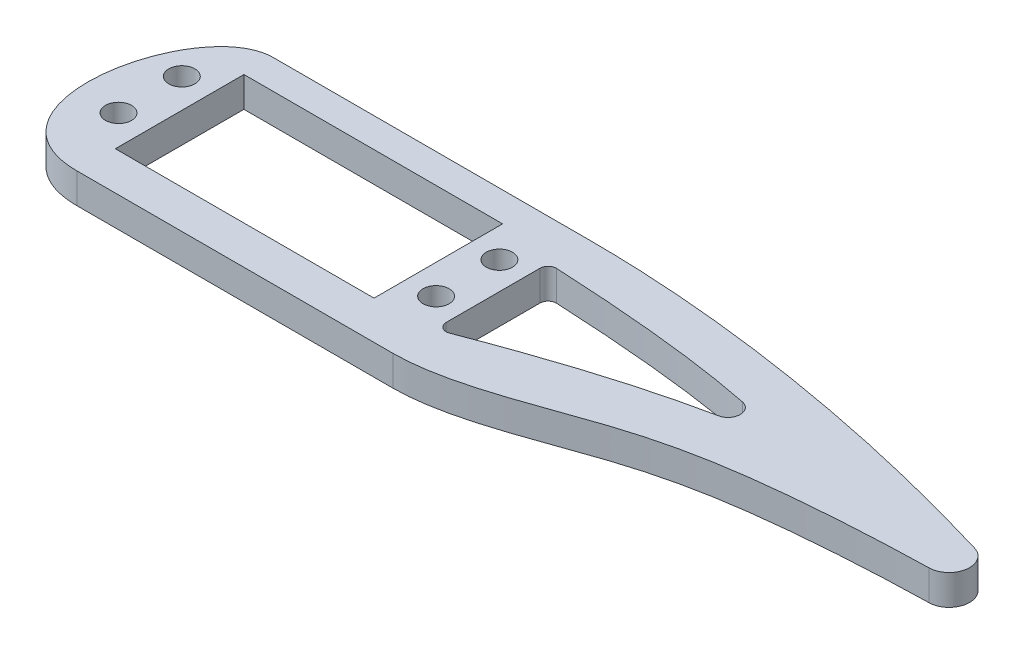
from build123d import *

# Parameters (mm, degrees)
BOSS_EXTRUDE1_DEPTH = 4.699
SKETCH2_R           = 1.905
SKETCH2_R_2         = 2.032
SKETCH2_W           = 40.259
SKETCH2_H           = 20.0152
CUT_EXTRUDE1_DEPTH  = 105.14657371
FILLET1_R           = 1.27


with BuildPart() as part:
    # Sketch1 → Boss-Extrude1 (new body)
    with BuildSketch(Plane(origin=(0, 0, 0), x_dir=(1, 0, 0), z_dir=(0, 1, 0))):
        with BuildLine():
            Line((-20.1295, 14.5796), (29.0195, 14.5796))
            add(Edge.make_bspline(
                [(29.0195, 14.5796), (61.676259281, 14.5796), (92.626496887, 5.406179728), (100.540261174, 3.042166683)],
                knots=[0, 0, 0, 0, 1, 1, 1, 1], degree=3))
            ThreePointArc((100.540261174, 3.042166683), (102.777881706, -0.425331821), (99.699916451, -3.174262779))
            add(Edge.make_bspline(
                [(29.0195, -15.9766), (36.752411566, -15.9766), (47.448783559, -11.662139755), (61.563248496, -6.964298313), (74.754433056, -4.344440996), (91.245915547, -3.356476028), (99.699916451, -3.174262779)],
                knots=[0, 0, 0, 0, 0.316402814, 0.381996868, 0.65594054, 1, 1, 1, 1], degree=3))
            Line((29.0195, -15.9766), (-20.1295, -15.9766))
            add(Edge.make_bspline(
                [(-20.1295, 14.5796), (-25.650459674, 14.5796), (-34.705495366, -0.225155417), (-29.383489197, -15.9766), (-20.1295, -15.9766)],
                knots=[0, 0, 0, 0, 0.484878873, 1, 1, 1, 1], degree=3))
        make_face()
    extrude(amount=BOSS_EXTRUDE1_DEPTH)

    # Sketch2 → Cut-Extrude1 (cut, through all)
    with BuildSketch(Plane(origin=(0, 4.699, 0), x_dir=(1, 0, 0), z_dir=(0, 1, 0))):
        with Locations((62.4205, 2.803132377)):
            Circle(SKETCH2_R)
        with Locations(Location((-24.71166, 4.92506, 0), (0, 0, 270))):
            Circle(SKETCH2_R_2)
        with Locations(Location((-24.71166, -4.92506, 0), (0, 0, 270))):
            Circle(SKETCH2_R_2)
        with Locations(Location((24.71166, -4.92506, 0), (0, 0, 270))):
            Circle(SKETCH2_R_2)
        with Locations(Location((24.71166, 4.92506, 0), (0, 0, 270))):
            Circle(SKETCH2_R_2)
        with BuildLine():
            Line((29.0195, 0), (29.0195, 8.262060115))
            add(Edge.make_bspline(
                [(29.0195, 8.262060115), (49.82184103, 7.331297412), (62.803182548, 4.669299323)],
                knots=[0, 0, 0, 1, 1, 1], degree=2))
            ThreePointArc((62.803182548, 4.669299323), (64.32549921, 2.801397362), (62.799782619, 0.936271457))
            add(Edge.make_bspline(
                [(62.799782619, 0.936271457), (48.06851018, -2.056621868), (29.0195, -9.517939885)],
                knots=[0, 0, 0, 1, 1, 1], degree=2))
            Line((29.0195, -9.517939885), (29.0195, 0))
        make_face()
        Rectangle(SKETCH2_W, SKETCH2_H)
    extrude(amount=-CUT_EXTRUDE1_DEPTH, mode=Mode.SUBTRACT)

    # Fillet1
    fillet1_edges = [part.edges().sort_by_distance(p)[0] for p in [
        (29.0195, 2.3495, 9.517939885),
        (29.0195, 2.3495, -8.262060115),
    ]]
    fillet(fillet1_edges, radius=FILLET1_R)


solid = part.part
